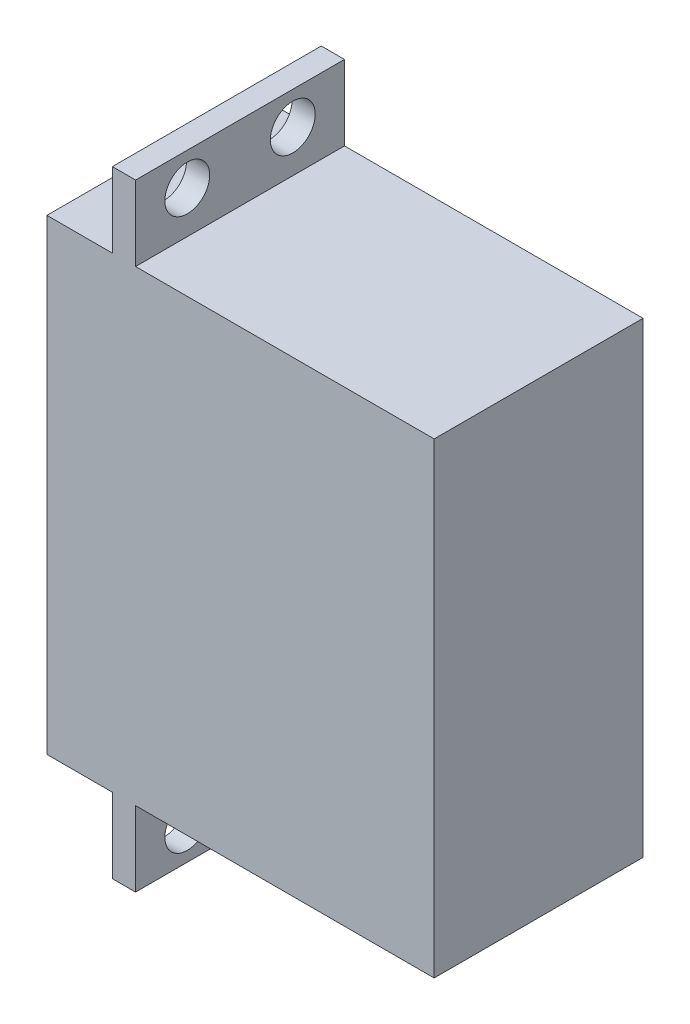
from build123d import *

# Parameters (mm, degrees)
SCHIZZO1_W                   = 40.3
SCHIZZO1_H                   = 44.25
ESTRUSIONE_ESTRUSIONE1_DEPTH = 19.8
SCHIZZO2_W                   = 19.8
SCHIZZO2_H                   = 44.25
SCHIZZO2_R                   = 2.9
TAGLIO_ESTRUSIONE1_DEPTH     = 3.6
SCHIZZO3_W                   = 2.2
SCHIZZO3_H                   = 19.8
ESTRUSIONE_ESTRUSIONE2_DEPTH = 7.1
SCHIZZO4_W                   = 2.2
SCHIZZO4_H                   = 19.8
ESTRUSIONE_ESTRUSIONE3_DEPTH = 7.1
SCHIZZO5_R                   = 2.125
TAGLIO_ESTRUSIONE2_DEPTH     = 7.1


with BuildPart() as part:
    # Schizzo1 → Estrusione-Estrusione1 (new body)
    with BuildSketch(Plane(origin=(0, 0, 0), x_dir=(-1, 0, 0), z_dir=(0, 0, 1))):
        with Locations((-79.25, -1.375)):
            Rectangle(SCHIZZO1_W, SCHIZZO1_H)
    extrude(amount=ESTRUSIONE_ESTRUSIONE1_DEPTH)

    # Schizzo2 → Taglio-Estrusione1 (cut)
    with BuildSketch(Plane.ZY.offset(-59.1)):
        with Locations((9.9, 1.375)):
            Rectangle(SCHIZZO2_W, SCHIZZO2_H)
        with Locations((9.9, 12.5)):
            Circle(SCHIZZO2_R, mode=Mode.SUBTRACT)
    extrude(amount=-TAGLIO_ESTRUSIONE1_DEPTH, mode=Mode.SUBTRACT)

    # Schizzo3 → Estrusione-Estrusione2 (add)
    with BuildSketch(Plane(origin=(0, 23.5, 0), x_dir=(1, 0, 0), z_dir=(0, 1, 0))):
        with Locations((70, -9.9)):
            Rectangle(SCHIZZO3_W, SCHIZZO3_H)
    extrude(amount=ESTRUSIONE_ESTRUSIONE2_DEPTH)

    # Schizzo4 → Estrusione-Estrusione3 (add)
    with BuildSketch(Plane.XZ.offset(20.75)):
        with Locations((70, 9.9)):
            Rectangle(SCHIZZO4_W, SCHIZZO4_H)
    extrude(amount=ESTRUSIONE_ESTRUSIONE3_DEPTH)

    # Schizzo5 → Taglio-Estrusione2 (cut)
    with BuildSketch(Plane.ZY.offset(-68.9)):
        with Locations(Location((14.9, 27.5, 0), (0, 0, 270))):
            Circle(SCHIZZO5_R)
        with Locations(Location((4.9, 27.5, 0), (0, 0, 270))):
            Circle(SCHIZZO5_R)
        with Locations(Location((14.9, -24.75, 0), (0, 0, 270))):
            Circle(SCHIZZO5_R)
        with Locations(Location((4.9, -24.75, 0), (0, 0, 270))):
            Circle(SCHIZZO5_R)
    extrude(amount=-TAGLIO_ESTRUSIONE2_DEPTH, mode=Mode.SUBTRACT)


solid = part.part
